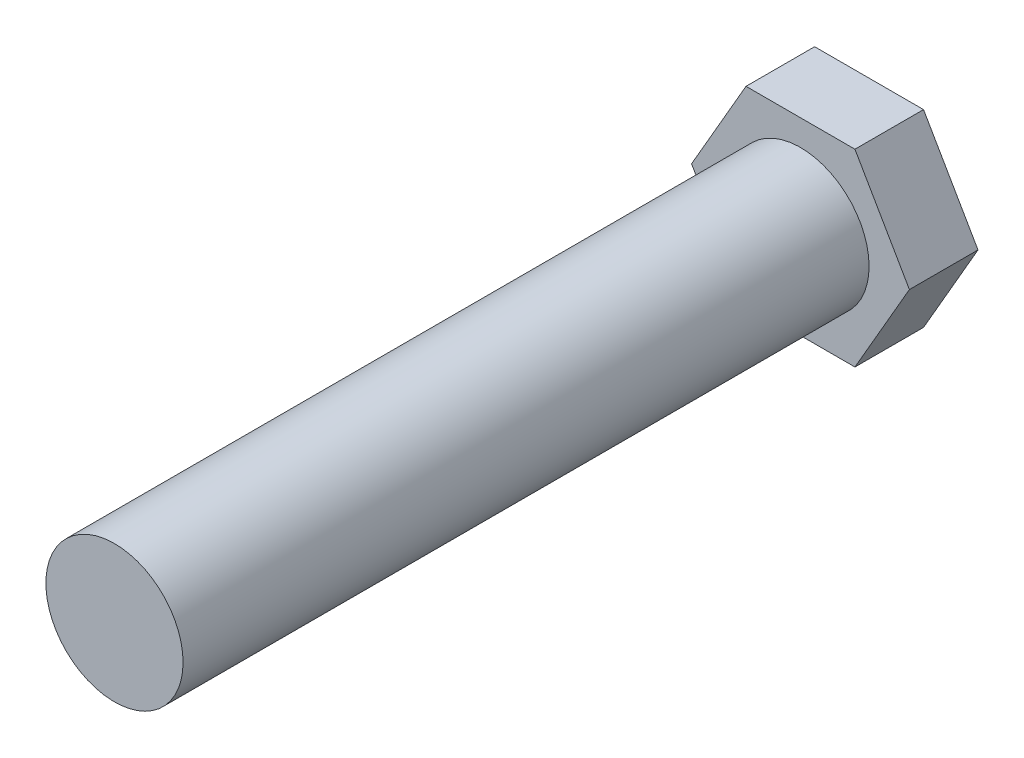
from build123d import *

# Parameters (mm, degrees)
BOSS_EXTRUDE1_DEPTH = 5.08
SKETCH2_R           = 5.08
BOSS_EXTRUDE2_DEPTH = 50.8


with BuildPart() as part:
    # Sketch1 → Boss-Extrude1 (new body)
    with BuildSketch(Plane.XY):
        Polygon((8.065583261, 0), (4.03279163, 6.985), (-4.03279163, 6.985), (-8.065583261, 0), (-4.03279163, -6.985), (4.03279163, -6.985), align=None)
    extrude(amount=BOSS_EXTRUDE1_DEPTH)

    # Sketch2 → Boss-Extrude2 (add)
    with BuildSketch(Plane.XY.offset(5.08)):
        Circle(SKETCH2_R)
    extrude(amount=BOSS_EXTRUDE2_DEPTH)


solid = part.part
